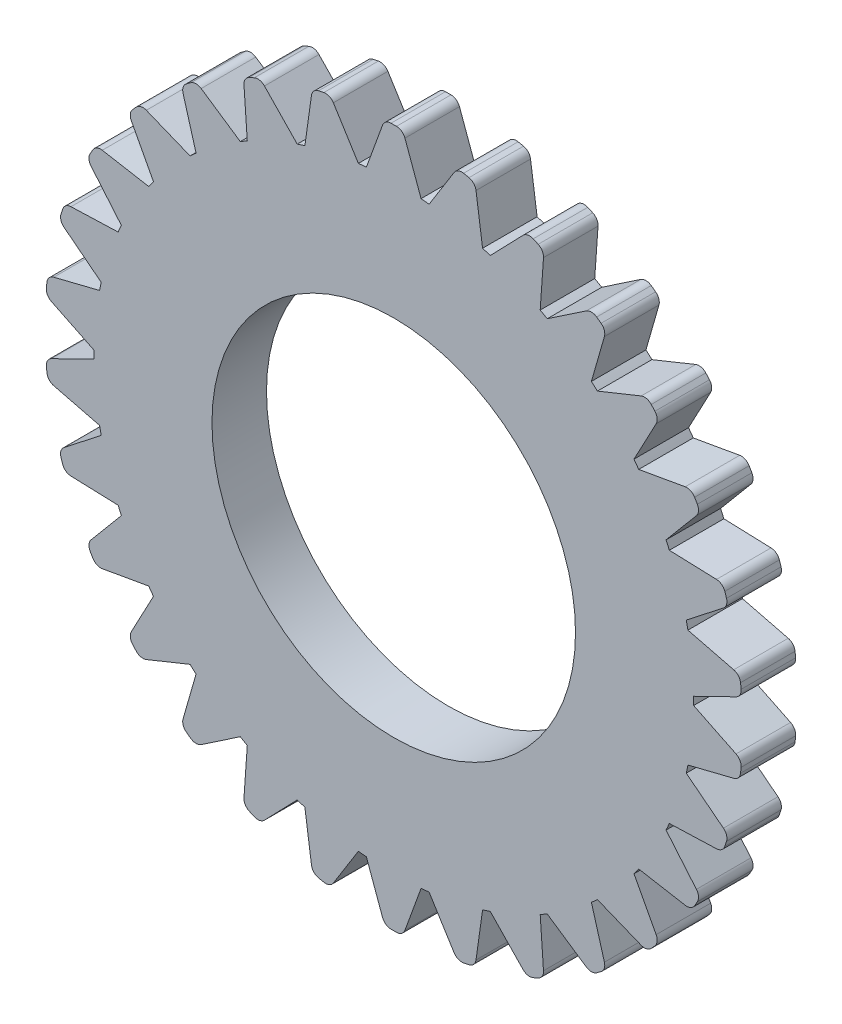
from build123d import *

# Parameters (mm, degrees)
SKETCH1_R           = 16.5
SKETCH1_R_2         = 10
BOSS_EXTRUDE1_DEPTH = 1.5
BOSS_EXTRUDE2_DEPTH = 3
CIRPATTERN1_COUNT   = 30


with BuildPart() as part:
    # Sketch1 → Boss-Extrude1 (new, symmetric)
    with BuildSketch(Plane.XY):
        Circle(SKETCH1_R)
        Circle(SKETCH1_R_2, mode=Mode.SUBTRACT)
    extrude(amount=BOSS_EXTRUDE1_DEPTH, both=True)

    # Sketch3 → Boss-Extrude2 (add)
    with BuildSketch(Plane.XY.offset(1.5)):
        with BuildLine():
            Line((-1.504025582, 16.431308744), (-0.61625553, 18.870436917))
            ThreePointArc((-0.61625553, 18.870436917), (-0.434798613, 19.107877035), (-0.150323904, 19.19941152))
            ThreePointArc((-0.150323904, 19.19941152), (0, 19.2), (0.150323904, 19.19941152))
            ThreePointArc((0.150323904, 19.19941152), (0.434798613, 19.107877035), (0.61625553, 18.870436917))
            Line((0.61625553, 18.870436917), (1.504025582, 16.431308744))
            ThreePointArc((1.504025582, 16.431308744), (0, 16.5), (-1.504025582, 16.431308744))
        make_face()
    boss_extrude2 = extrude(amount=-BOSS_EXTRUDE2_DEPTH)

    # CirPattern1: Boss-Extrude2 ×30 about axis
    cirpattern1_axis = Axis((0, 0, 0), (0, 0, 1))
    for i in range(1, CIRPATTERN1_COUNT):
        add(boss_extrude2.rotate(cirpattern1_axis, i * 360 / CIRPATTERN1_COUNT))


solid = part.part
